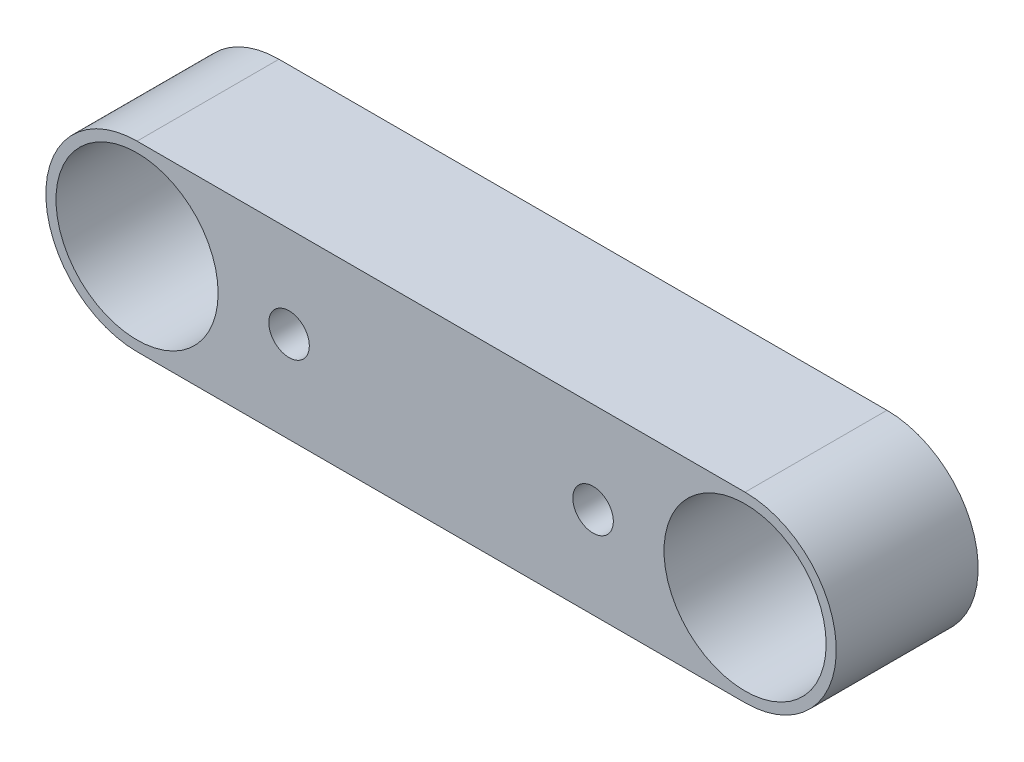
from build123d import *

# Parameters (mm, degrees)
SKETCH1_R           = 2
SKETCH1_R_2         = 8
BOSS_EXTRUDE1_DEPTH = 7


with BuildPart() as part:
    # Sketch1 → Boss-Extrude1 (new, symmetric)
    with BuildSketch(Plane.XY):
        with BuildLine():
            Line((-30, 9), (30, 9))
            ThreePointArc((30, 9), (39, 0), (30, -9))
            Line((30, -9), (-30, -9))
            ThreePointArc((-30, -9), (-39, 0), (-30, 9))
        make_face()
        with Locations((-15, 0)):
            Circle(SKETCH1_R, mode=Mode.SUBTRACT)
        with Locations((15, 0)):
            Circle(SKETCH1_R, mode=Mode.SUBTRACT)
        with Locations((-30, 0)):
            Circle(SKETCH1_R_2, mode=Mode.SUBTRACT)
        with Locations((30, 0)):
            Circle(SKETCH1_R_2, mode=Mode.SUBTRACT)
    extrude(amount=BOSS_EXTRUDE1_DEPTH, both=True)


solid = part.part
